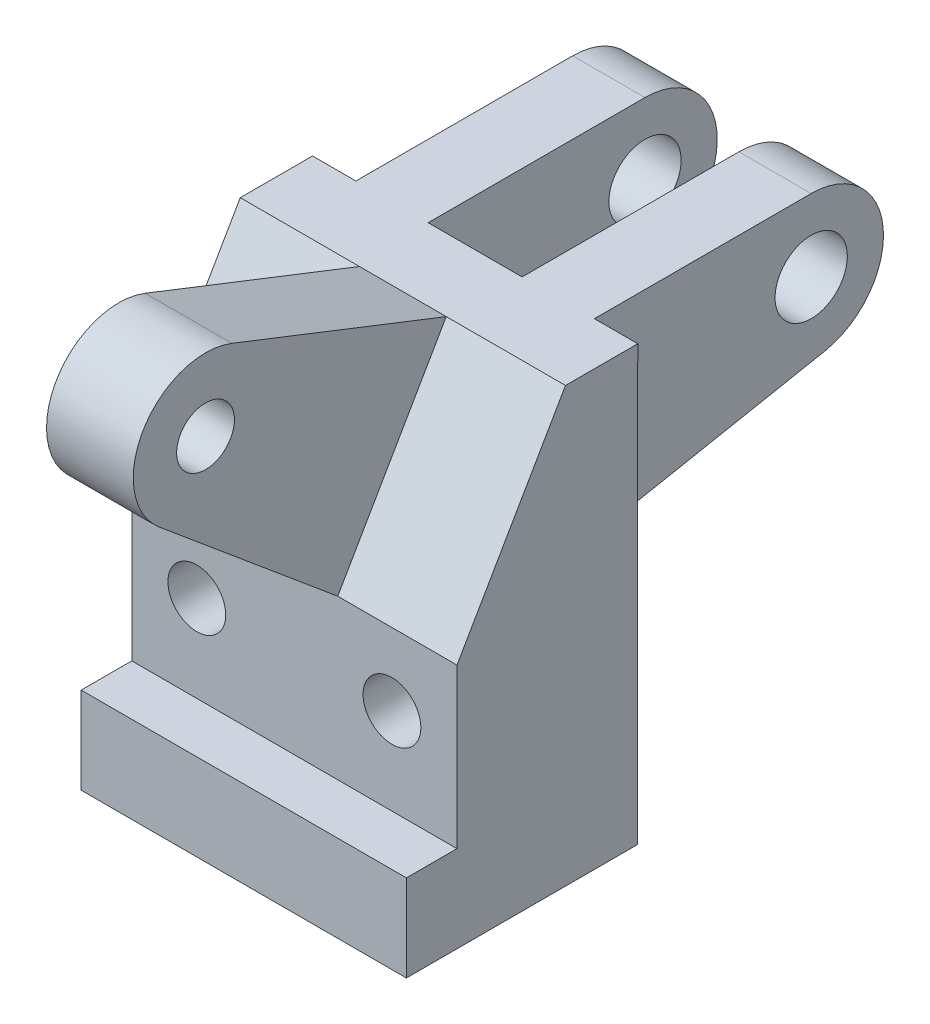
from build123d import *

# Parameters (mm, degrees)
BOSS_EXTRUDE1_DEPTH = 22.5
BOSS_EXTRUDE2_START = 6.5
SKETCH2_R           = 5
BOSS_EXTRUDE2_DEPTH = 10
BOSS_EXTRUDE3_START = -16.5
SKETCH2_2_R         = 5
BOSS_EXTRUDE3_DEPTH = 10
SKETCH3_R           = 4
BOSS_EXTRUDE4_DEPTH = 6
SKETCH4_R           = 4
CUT_EXTRUDE1_DEPTH  = 100.824444172


with BuildPart() as part:
    # Sketch1 → Boss-Extrude1 (new, symmetric)
    with BuildSketch(Plane(origin=(0, 0, 0), x_dir=(0, 0, -1), z_dir=(1, 0, 0))):
        Polygon((-16, 0.019237886), (16, 0.019237886), (16.011106999, 60.019237886), (6.011106999, 60.019237886), (-9, 34.019237886), (-9, 12.019237886), (-16, 12.019237886), align=None)
    extrude(amount=BOSS_EXTRUDE1_DEPTH, both=True)

    # Sketch2 → Boss-Extrude2 (add)
    with BuildSketch(Plane(origin=(0, 0, 0), x_dir=(0, 0, -1), z_dir=(1, 0, 0)).offset(BOSS_EXTRUDE2_START)):
        with BuildLine():
            Line((16.006293966, 34.019238332), (16.011106999, 60.019237886))
            Line((16.011106999, 60.019237886), (46.011106999, 60.019237886))
            ThreePointArc((46.011106999, 60.019237886), (55.965350951, 50.974762528), (47.913412075, 40.201843354))
            Line((47.913412075, 40.201843354), (16.006293966, 34.019238332))
        make_face()
        with Locations((46.011106999, 50.019237886)):
            Circle(SKETCH2_R, mode=Mode.SUBTRACT)
    extrude(amount=BOSS_EXTRUDE2_DEPTH)

    # Sketch2<2> → Boss-Extrude3 (add)
    with BuildSketch(Plane(origin=(0, 0, 0), x_dir=(0, 0, -1), z_dir=(1, 0, 0)).offset(BOSS_EXTRUDE3_START)):
        with BuildLine():
            Line((16.006293966, 34.019238332), (16.011106999, 60.019237886))
            Line((16.011106999, 60.019237886), (46.011106999, 60.019237886))
            ThreePointArc((46.011106999, 60.019237886), (55.965350951, 50.974762528), (47.913412075, 40.201843354))
            Line((47.913412075, 40.201843354), (16.006293966, 34.019238332))
        make_face()
        with Locations((46.011106999, 50.019237886)):
            Circle(SKETCH2_2_R, mode=Mode.SUBTRACT)
    extrude(amount=BOSS_EXTRUDE3_DEPTH)

    # Sketch3 → Boss-Extrude4 (add, symmetric)
    with BuildSketch(Plane(origin=(0, 0, 0), x_dir=(0, 0, -1), z_dir=(1, 0, 0))):
        with BuildLine():
            Line((6.011106999, 60.019237886), (-9, 34.019237886))
            Line((-9, 34.019237886), (-33.705019764, 54.660061974))
            ThreePointArc((-33.705019764, 54.660061974), (-35.89708202, 67.430869171), (-23.643692341, 71.644311323))
            Line((-23.643692341, 71.644311323), (6.011106999, 60.019237886))
        make_face()
        with Locations((-27.293408528, 62.334124872)):
            Circle(SKETCH3_R, mode=Mode.SUBTRACT)
    extrude(amount=BOSS_EXTRUDE4_DEPTH, both=True)

    # Sketch4 → Cut-Extrude1 (cut, through all)
    with BuildSketch(Plane.XY.offset(9)):
        with Locations((-13.5, 24.019237886)):
            Circle(SKETCH4_R)
        with Locations((13.5, 24.019237886)):
            Circle(SKETCH4_R)
    extrude(amount=-CUT_EXTRUDE1_DEPTH, mode=Mode.SUBTRACT)


solid = part.part
